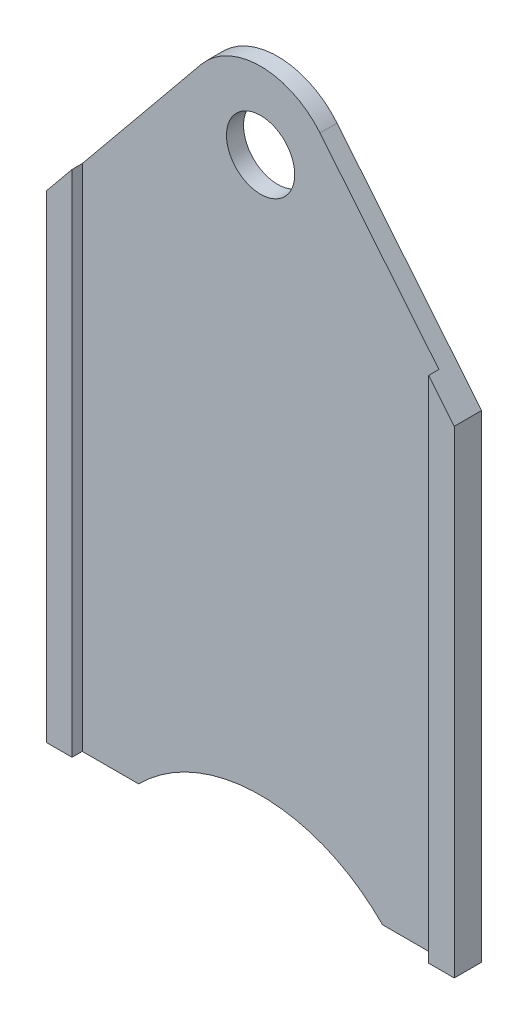
from build123d import *

# Parameters (mm, degrees)
ESQUISSE1_R        = 4
BOSS_EXTRU_1_DEPTH = 2
BOSS_EXTRU_2_DEPTH = 1.2


with BuildPart() as part:
    # Esquisse1 → Boss.-Extru.1 (new body)
    with BuildSketch(Plane.XY):
        with BuildLine():
            Line((-23.9, 14), (-14.282856857, 14))
            ThreePointArc((-14.282856857, 14), (0, 20), (14.282856857, 14))
            Line((14.282856857, 14), (23.9, 14))
            Line((23.9, 14), (23.9, 70))
            Line((23.9, 70), (6.965826107, 90.69888293))
            ThreePointArc((6.965826107, 90.69888293), (0, 94), (-6.965826107, 90.69888293))
            Line((-6.965826107, 90.69888293), (-23.9, 70))
            Line((-23.9, 70), (-23.9, 14))
        make_face()
        with Locations((0, 85)):
            Circle(ESQUISSE1_R, mode=Mode.SUBTRACT)
    extrude(amount=BOSS_EXTRU_1_DEPTH)

    # Esquisse2 → Boss.-Extru.2 (add)
    with BuildSketch(Plane.XY.offset(2)):
        Polygon((-23.9, 14), (-20.9, 14), (-20.9, 73.666942904), (-23.9, 70), align=None)
        Polygon((23.9, 14), (20.9, 14), (20.9, 73.666942904), (23.9, 70), align=None)
    extrude(amount=BOSS_EXTRU_2_DEPTH)


solid = part.part
